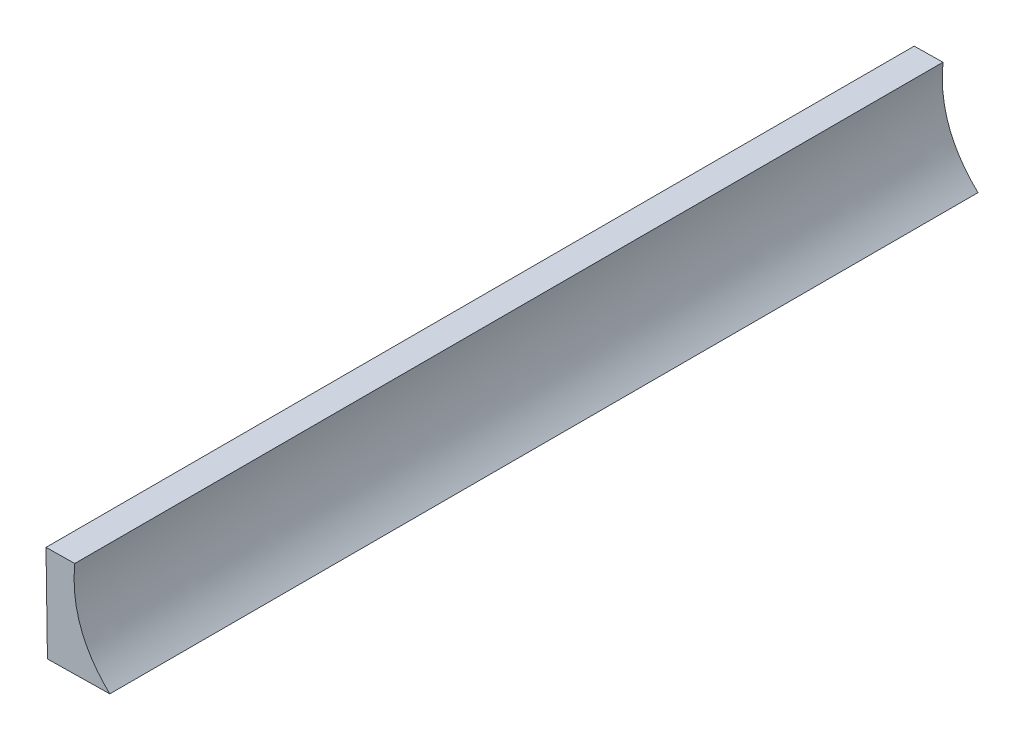
from build123d import *

# Parameters (mm, degrees)
BOSS_EXTRU_1_DEPTH = 181


with BuildPart() as part:
    # Esquisse1 → Boss.-Extru.1 (new body)
    with BuildSketch(Plane.XY):
        with BuildLine():
            Line((-55.512775802, 21.37020417), (-49.512775802, 21.460479123))
            add(Edge.make_bspline(
                [(-49.512775802, 21.460479123), (-50.710090217, 9.621363587), (-42.211859293, 1.565799901)],
                knots=[0, 0, 0, 1, 1, 1], degree=2))
            Line((-42.211859293, 1.565799901), (-55.211859293, 1.37020417))
            Line((-55.211859293, 1.37020417), (-55.512775802, 21.37020417))
        make_face()
    extrude(amount=BOSS_EXTRU_1_DEPTH)


solid = part.part
